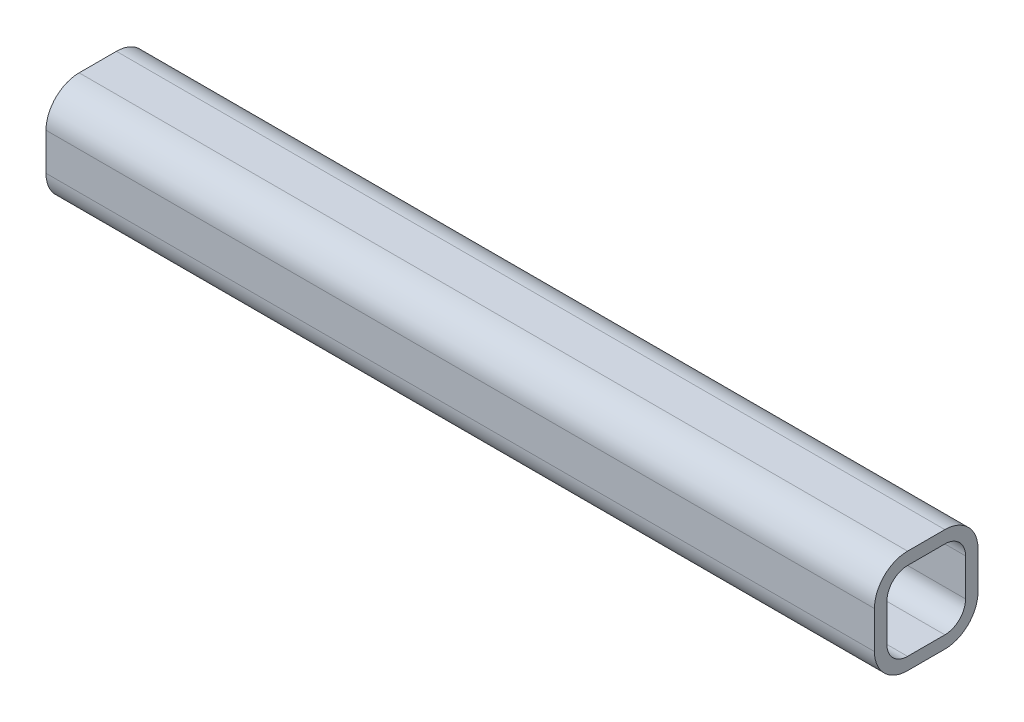
from build123d import *


with BuildPart() as part:
    # Sweep-Thin1: sweep along a path in Sketch3
    with BuildLine(Plane(origin=(0, 0, 0), x_dir=(1, 0, 0), z_dir=(0, 1, 0))) as sweep_thin1_path:
        Line((0, 0), (200, 0))
    # Sketch2 → Sweep-Thin1 (sweep)
    with BuildSketch(Plane(origin=(0, 0, 0), x_dir=(0, 0, -1), z_dir=(1, 0, 0))):
        with BuildLine():
            Line((4.5, 12.5), (-4.5, 12.5))
            ThreePointArc((-4.5, 12.5), (-10.156854249, 10.156854249), (-12.5, 4.5))
            Line((-12.5, 4.5), (-12.5, -4.5))
            ThreePointArc((-12.5, -4.5), (-10.156854249, -10.156854249), (-4.5, -12.5))
            Line((-4.5, -12.5), (4.5, -12.5))
            ThreePointArc((4.5, -12.5), (10.156854249, -10.156854249), (12.5, -4.5))
            Line((12.5, -4.5), (12.5, 4.5))
            ThreePointArc((12.5, 4.5), (10.156854249, 10.156854249), (4.5, 12.5))
        make_face()
        with BuildLine():
            Line((4.5, 9.5), (-4.5, 9.5))
            ThreePointArc((-4.5, 9.5), (-8.035533906, 8.035533906), (-9.5, 4.5))
            Line((-9.5, 4.5), (-9.5, -4.5))
            ThreePointArc((-9.5, -4.5), (-8.035533906, -8.035533906), (-4.5, -9.5))
            Line((-4.5, -9.5), (4.5, -9.5))
            ThreePointArc((4.5, -9.5), (8.035533906, -8.035533906), (9.5, -4.5))
            Line((9.5, -4.5), (9.5, 4.5))
            ThreePointArc((9.5, 4.5), (8.035533906, 8.035533906), (4.5, 9.5))
        make_face(mode=Mode.SUBTRACT)
    sweep(path=sweep_thin1_path.line)


solid = part.part
